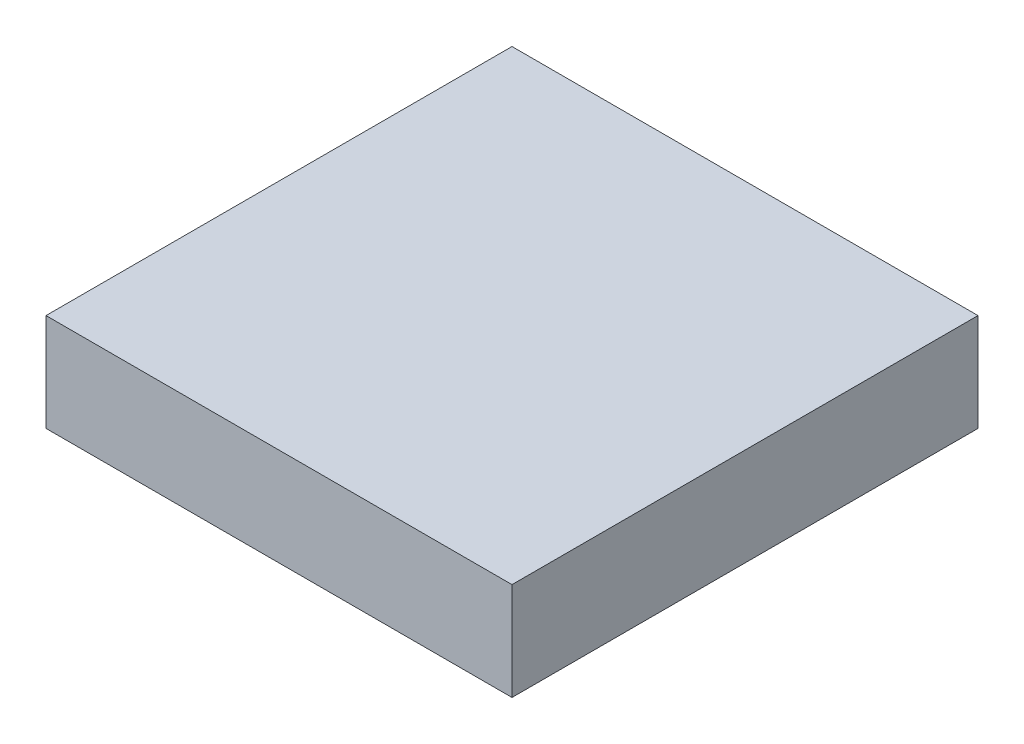
from build123d import *

# Parameters (mm, degrees)
SKETCH1_W           = 2.436
SKETCH1_H           = 2.436
BOSS_EXTRUDE1_DEPTH = 0.511


with BuildPart() as part:
    # Sketch1 → Boss-Extrude1 (new body)
    with BuildSketch(Plane(origin=(0, 0, 0), x_dir=(1, 0, 0), z_dir=(0, 1, 0))):
        with Locations((1.218, 1.218)):
            Rectangle(SKETCH1_W, SKETCH1_H)
    extrude(amount=BOSS_EXTRUDE1_DEPTH)


solid = part.part
